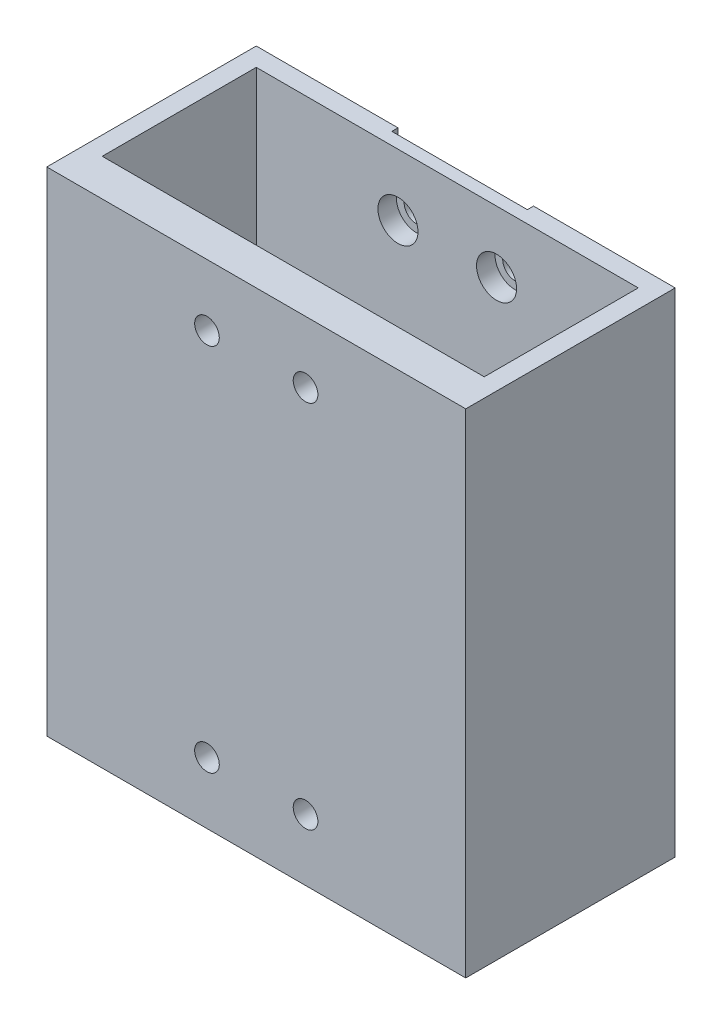
from build123d import *

# Parameters (mm, degrees)
SKETCH_1_W          = 68
SKETCH_1_H          = 31
SKETCH_1_W_2        = 62
SKETCH_1_H_2        = 25
EXTRUDE_1_DEPTH     = 20
SKETCH_2_W          = 22
SKETCH_2_H          = 1
CUT_EXTRUDE_1_DEPTH = 6
SKETCH_3_R          = 2
CUT_EXTRUDE_2_DEPTH = 3
EXTRUDE_2_DEPTH     = 3
SKETCH_6_R          = 2
CUT_EXTRUDE_3_DEPTH = 49.37354649
SKETCH_8_R          = 3.25
CUT_EXTRUDE_6_DEPTH = 3
SKETCH_9_W          = 68
SKETCH_9_H          = 31
SKETCH_9_W_2        = 62
SKETCH_9_H_2        = 25
EXTRUDE_3_DEPTH     = 60
EXTRUDE_START       = 3
SKETCH_11_W         = 68
SKETCH_11_H         = 80
SKETCH_11_R         = 2
EXTRUDE_5_DEPTH     = 3
SKETCH_12_R         = 6
CUT_EXTRUDE_7_DEPTH = 3


with BuildPart() as part:
    # 草图1 → 凸台-拉伸1 (new body)
    with BuildSketch(Plane(origin=(0, 0, 0), x_dir=(1, 0, 0), z_dir=(0, 1, 0))):
        Rectangle(SKETCH_1_W, SKETCH_1_H)
        Rectangle(SKETCH_1_W_2, SKETCH_1_H_2, mode=Mode.SUBTRACT)
    extrude(amount=EXTRUDE_1_DEPTH)

    # 草图2 → 切除-拉伸1 (cut)
    with BuildSketch(Plane(origin=(0, 20, 0), x_dir=(1, 0, 0), z_dir=(0, 1, 0))):
        with Locations((0, 15)):
            Rectangle(SKETCH_2_W, SKETCH_2_H)
    extrude(amount=-CUT_EXTRUDE_1_DEPTH, mode=Mode.SUBTRACT)

    # 草图3 → 切除-拉伸2 (cut)
    with BuildSketch(Plane(origin=(0, 0, -15.5), x_dir=(-1, 0, 0), z_dir=(0, 0, -1))):
        with Locations((-8, 10)):
            Circle(SKETCH_3_R)
        with Locations((8, 10)):
            Circle(SKETCH_3_R)
    extrude(amount=-CUT_EXTRUDE_2_DEPTH, mode=Mode.SUBTRACT)

    # 草图4 → 凸台-拉伸2 (add)
    with BuildSketch(Plane(origin=(0, 0, -15.5), x_dir=(-1, 0, 0), z_dir=(0, 0, -1))):
        Polygon((-11, 14), (-13, 14), (-13, 4), (-11, 4), (11, 4), (13, 4), (13, 14), (11, 14), align=None)
    extrude(amount=EXTRUDE_2_DEPTH)

    # 草图6 → 切除-拉伸3 (cut, symmetric)
    with BuildSketch(Plane.XY.offset(-12.5)):
        with Locations((-8, 10)):
            Circle(SKETCH_6_R)
        with Locations((8, 10)):
            Circle(SKETCH_6_R)
    cut_extrude_3 = extrude(amount=CUT_EXTRUDE_3_DEPTH, both=True, mode=Mode.SUBTRACT)

    # 草图8 → 切除-拉伸6 (cut)
    with BuildSketch(Plane.XY.offset(-12.5)):
        with Locations((-8, 10)):
            Circle(SKETCH_8_R)
        with Locations((8, 10)):
            Circle(SKETCH_8_R)
    extrude(amount=-CUT_EXTRUDE_6_DEPTH, mode=Mode.SUBTRACT)

    # 草图9 → 凸台-拉伸3 (add)
    with BuildSketch(Plane.XZ):
        Rectangle(SKETCH_9_W, SKETCH_9_H)
        Rectangle(SKETCH_9_W_2, SKETCH_9_H_2, mode=Mode.SUBTRACT)
    extrude(amount=EXTRUDE_3_DEPTH)

    # 草图11 → 凸台-拉伸5 (add)
    with BuildSketch(Plane.XY.offset(15.5).offset(EXTRUDE_START)):
        with Locations((0, -20)):
            Rectangle(SKETCH_11_W, SKETCH_11_H)
        with Locations((-8, 10)):
            Circle(SKETCH_11_R, mode=Mode.SUBTRACT)
        with Locations((8, 10)):
            Circle(SKETCH_11_R, mode=Mode.SUBTRACT)
    extrude(amount=-EXTRUDE_5_DEPTH)

    # 草图12 → 切除-拉伸7 (cut)
    with BuildSketch(Plane(origin=(0, 0, 12.5), x_dir=(-1, 0, 0), z_dir=(0, 0, -1))):
        with Locations((-8, 10)):
            Circle(SKETCH_12_R)
        with Locations((8, 10)):
            Circle(SKETCH_12_R)
    cut_extrude_7 = extrude(amount=-CUT_EXTRUDE_7_DEPTH, mode=Mode.SUBTRACT)

    # 镜向1: 切除-拉伸3, 切除-拉伸7 across plane
    add(cut_extrude_3.mirror(Plane.ZX.offset(-20)), mode=Mode.SUBTRACT)
    add(cut_extrude_7.mirror(Plane.ZX.offset(-20)), mode=Mode.SUBTRACT)


solid = part.part
